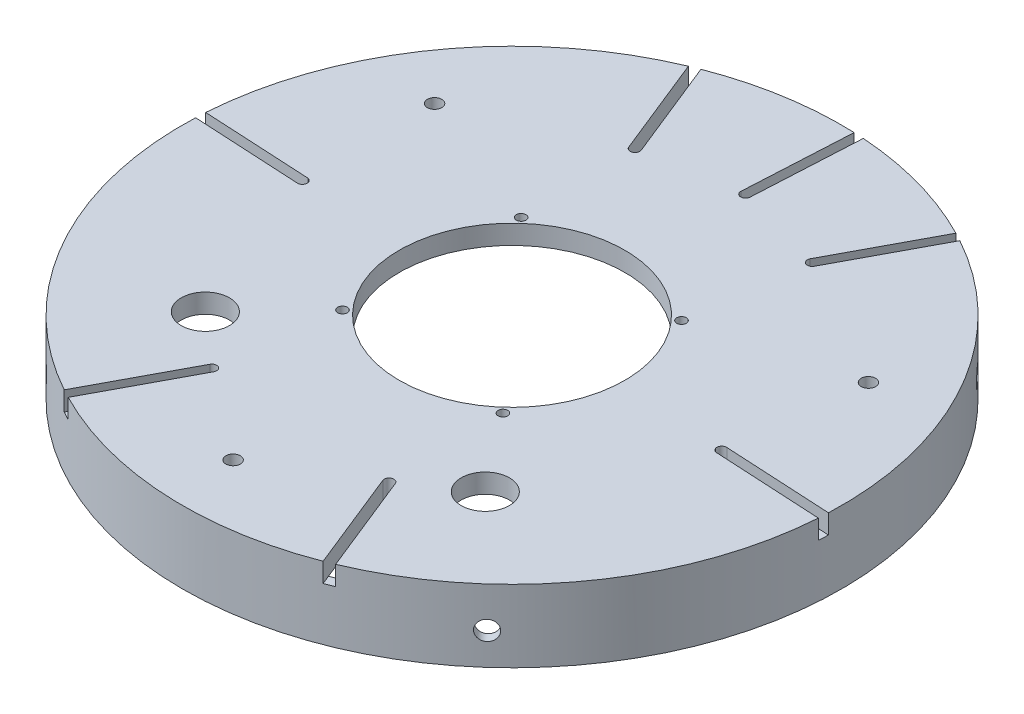
from build123d import *

# Parameters (mm, degrees)
SKETCH1_R                = 68.369999998
SKETCH1_R_2              = 23.401
BOSS_EXTRUDE1_DEPTH      = 2
BOSS_EXTRUDE2_START      = -13
SKETCH3_R                = 68.369999998
SKETCH3_R_2              = 66.37
BOSS_EXTRUDE2_DEPTH      = 13
CUT_EXTRUDE40_DEPTH      = 114.575806629
CUT_EXTRUDE40_DEPTH_BACK = 114.575806629
SKETCH63_R               = 2
CUT_EXTRUDE41_DEPTH      = 160.130961581
CUT_EXTRUDE41_DEPTH_BACK = 160.130961581
SKETCH64_R               = 2
CUT_EXTRUDE45_DEPTH      = 2
SKETCH73_R               = 1
CUT_EXTRUDE47_DEPTH      = 10
SKETCH70_R               = 1.5
CUT_EXTRUDE48_DEPTH      = 10
SKETCH74_R               = 5
CUT_EXTRUDE49_DEPTH      = 10
CUT_EXTRUDE51_START      = -2
CUT_EXTRUDE51_DEPTH      = 2
SKETCH80_R               = 5
SKETCH80_R_2             = 1.5
SKETCH80_R_3             = 1
SKETCH80_R_4             = 23.401
BOSS_EXTRUDE4_DEPTH      = 2


with BuildPart() as part:
    # Sketch1 → Boss-Extrude1 (new body)
    with BuildSketch(Plane(origin=(0, 0, 0), x_dir=(-0.9985653746512714, 0, -0.053546172109368295), z_dir=(0, 1, 0))):
        with Locations(Location((55.498672647, -32.344920806, 0), (0, 0, 93.069437642))):
            Circle(SKETCH1_R)
        with Locations(Location((55.498672647, -32.344920806, 0), (0, 0, 93.069437642))):
            Circle(SKETCH1_R_2, mode=Mode.SUBTRACT)
    extrude(amount=BOSS_EXTRUDE1_DEPTH)

    # Sketch3 → Boss-Extrude2 (add)
    with BuildSketch(Plane(origin=(0, 2, 0), x_dir=(1, 0, 0), z_dir=(0, 1, 0)).offset(BOSS_EXTRUDE2_START)):
        with Locations(Location((-53.687106148, 35.27025944, 0), (0, 0, 270))):
            Circle(SKETCH3_R)
        with Locations(Location((-53.687106148, 35.27025944, 0), (0, 0, 270))):
            Circle(SKETCH3_R_2, mode=Mode.SUBTRACT)
    extrude(amount=BOSS_EXTRUDE2_DEPTH)

    # Sketch63 → Cut-Extrude40 (cut, two sides: drawn at the far end of the back side and taken through both)
    with BuildSketch(Plane(origin=(-41.506941316, 0, -46.21062949), x_dir=(0.7439552092791144, 2.284460434874975e-13, -0.6682294864688846), z_dir=(0.6682294864688846, -2.5433421830845933e-13, 0.7439552092791144)).offset(-CUT_EXTRUDE40_DEPTH_BACK)):
        with Locations((-16.372174937, -4.35)):
            Circle(SKETCH63_R)
    extrude(amount=CUT_EXTRUDE40_DEPTH + CUT_EXTRUDE40_DEPTH_BACK, mode=Mode.SUBTRACT)

    # Sketch64 → Cut-Extrude41 (cut, two sides: drawn at the far end of the back side and taken through both)
    with BuildSketch(Plane(origin=(-12.180164832, 0, 10.94037005), x_dir=(-0.668229486468876, 1.5883353274739987e-15, -0.743955209279122), z_dir=(0.743955209279122, -1.7683301393964735e-15, -0.668229486468876)).offset(-CUT_EXTRUDE41_DEPTH_BACK)):
        with Locations((62.114800614, -4.35)):
            Circle(SKETCH64_R)
    extrude(amount=CUT_EXTRUDE41_DEPTH + CUT_EXTRUDE41_DEPTH_BACK, mode=Mode.SUBTRACT)

    # Sketch67 → Cut-Extrude45 (cut)
    with BuildSketch(Plane(origin=(0, 2, 0), x_dir=(1, 0, 0), z_dir=(0, 1, 0))):
        with BuildLine():
            Line((-47.831144931, 125.709400378), (-49.82827568, 125.816492726))
            Line((-49.82827568, 125.816492726), (-52.215508738, 81.297751413))
            ThreePointArc((-52.215508738, 81.297751413), (-51.270489538, 80.245639864), (-50.218377989, 81.190659065))
            Line((-50.218377989, 81.190659065), (-47.831144931, 125.709400378))
        make_face()
        with BuildLine():
            Line((-144.126247086, 41.126220657), (-144.233339434, 39.129089908))
            Line((-144.233339434, 39.129089908), (-99.714598121, 36.741856849))
            ThreePointArc((-99.714598121, 36.741856849), (-98.662486572, 37.68687605), (-99.607505773, 38.738987598))
            Line((-99.607505773, 38.738987598), (-144.126247086, 41.126220657))
        make_face()
        with BuildLine():
            Line((36.75203479, 29.414298222), (36.859127139, 31.411428971))
            Line((36.859127139, 31.411428971), (-7.659614175, 33.79866203))
            ThreePointArc((-7.659614175, 33.79866203), (-8.711725723, 32.853642829), (-7.766706523, 31.801531281))
            Line((-7.766706523, 31.801531281), (36.75203479, 29.414298222))
        make_face()
    extrude(amount=-CUT_EXTRUDE45_DEPTH, mode=Mode.SUBTRACT)

    # Sketch73 → Cut-Extrude47 (cut)
    with BuildSketch(Plane.XZ.offset(-2)):
        with Locations(Location((-72.2141021, -18.632644766, 0), (0, 0, 90))):
            Circle(SKETCH73_R)
        with Locations(Location((-37.049491474, -16.743263487, 0), (0, 0, 90))):
            Circle(SKETCH73_R)
        with Locations(Location((-35.160110195, -51.907874114, 0), (0, 0, 90))):
            Circle(SKETCH73_R)
        with Locations(Location((-70.324720822, -53.797255392, 0), (0, 0, 90))):
            Circle(SKETCH73_R)
    extrude(amount=CUT_EXTRUDE47_DEPTH, mode=Mode.SUBTRACT)

    # Sketch70 → Cut-Extrude48 (cut)
    with BuildSketch(Plane(origin=(0, 2, 0), x_dir=(1, 0, 0), z_dir=(0, 1, 0))):
        with Locations(Location((-99.774462502, 65.286181619, 0), (0, 0, 270))):
            Circle(SKETCH70_R)
        with Locations(Location((-56.637979096, -19.650523046, 0), (0, 0, 270))):
            Circle(SKETCH70_R)
        with Locations(Location((-4.648876845, 60.175119746, 0), (0, 0, 270))):
            Circle(SKETCH70_R)
    extrude(amount=-CUT_EXTRUDE48_DEPTH, mode=Mode.SUBTRACT)

    # Sketch74 → Cut-Extrude49 (cut)
    with BuildSketch(Plane(origin=(19.562495047, 3, -2.053609117), x_dir=(1, 0, 0), z_dir=(0, 1, 0))):
        with Locations(Location((-105.702188225, 2.042468777, 0), (0, 0, 270))):
            Circle(SKETCH74_R)
        with Locations(Location((-44.324158759, -1.255349618, 0), (0, 0, 270))):
            Circle(SKETCH74_R)
    extrude(amount=-CUT_EXTRUDE49_DEPTH, mode=Mode.SUBTRACT)

    # Sketch75 → Cut-Extrude51 (cut)
    with BuildSketch(Plane(origin=(0, 2, 0), x_dir=(1, 0, 0), z_dir=(0, 1, 0)).offset(CUT_EXTRUDE51_START)):
        with BuildLine():
            ThreePointArc((-78.28711428, 99.061297209), (-79.21750955, 98.694666428), (-80.142442845, 98.314466628))
            Line((-80.142442845, 98.314466628), (-79.765783898, 97.378744227))
            Line((-79.765783898, 97.378744227), (-71.802851111, 77.596671772))
            ThreePointArc((-71.802851111, 77.596671772), (-70.501771538, 77.04242278), (-69.947522546, 78.343502353))
            Line((-69.947522546, 78.343502353), (-77.910455333, 98.125574808))
            Line((-77.910455333, 98.125574808), (-78.28711428, 99.061297209))
        make_face()
        with BuildLine():
            Line((-21.107609811, 94.229039398), (-20.63291657, 95.119047657))
            ThreePointArc((-20.63291657, 95.119047657), (-21.511818593, 95.596106061), (-22.397604199, 96.060258351))
            Line((-22.397604199, 96.060258351), (-22.872297441, 95.170250092))
            Line((-22.872297441, 95.170250092), (-32.907769586, 76.354618611))
            ThreePointArc((-32.907769586, 76.354618611), (-32.496031118, 75.00166945), (-31.143081956, 75.413407918))
            Line((-31.143081956, 75.413407918), (-21.107609811, 94.229039398))
        make_face()
        with BuildLine():
            Line((-76.23113034, -4.872889039), (-86.266602485, -23.688520519))
            Line((-86.266602485, -23.688520519), (-86.741295726, -24.578528778))
            ThreePointArc((-86.741295726, -24.578528778), (-85.862393702, -25.055587182), (-84.976608096, -25.519739471))
            Line((-84.976608096, -25.519739471), (-84.501914855, -24.629731212))
            Line((-84.501914855, -24.629731212), (-74.46644271, -5.814099732))
            ThreePointArc((-74.46644271, -5.814099732), (-74.878181178, -4.461150571), (-76.23113034, -4.872889039))
        make_face()
        with BuildLine():
            Line((-29.463756963, -27.585055929), (-29.087098016, -28.52077833))
            ThreePointArc((-29.087098016, -28.52077833), (-28.156702745, -28.154147549), (-27.231769451, -27.773947749))
            Line((-27.231769451, -27.773947749), (-27.608428398, -26.838225348))
            Line((-27.608428398, -26.838225348), (-35.571361185, -7.056152893))
            ThreePointArc((-35.571361185, -7.056152893), (-36.872440758, -6.501903901), (-37.42668975, -7.802983474))
            Line((-37.42668975, -7.802983474), (-29.463756963, -27.585055929))
        make_face()
    extrude(amount=CUT_EXTRUDE51_DEPTH, mode=Mode.SUBTRACT)

    # Sketch80 → Boss-Extrude4 (add)
    with BuildSketch(Plane(origin=(0, 2, 0), x_dir=(1, 0, 0), z_dir=(0, 1, 0))):
        with BuildLine():
            Line((-29.087098016, -28.52077833), (-37.42668975, -7.802983474))
            ThreePointArc((-37.42668975, -7.802983474), (-36.872440758, -6.501903901), (-35.571361185, -7.056152893))
            Line((-35.571361185, -7.056152893), (-27.231769451, -27.773947749))
            ThreePointArc((-27.231769451, -27.773947749), (1.922948187, -4.503837114), (14.523625835, 30.606254489))
            Line((14.523625835, 30.606254489), (-7.766706523, 31.801531281))
            ThreePointArc((-7.766706523, 31.801531281), (-8.711725723, 32.853642829), (-7.659614175, 33.79866203))
            Line((-7.659614175, 33.79866203), (14.630861042, 32.603377578))
            ThreePointArc((14.630861042, 32.603377578), (5.862291778, 68.860825176), (-20.63291657, 95.119047657))
            Line((-20.63291657, 95.119047657), (-31.143081956, 75.413407918))
            ThreePointArc((-31.143081956, 75.413407918), (-32.496031118, 75.00166945), (-32.907769586, 76.354618611))
            Line((-32.907769586, 76.354618611), (-22.397604199, 96.060258351))
            ThreePointArc((-22.397604199, 96.060258351), (-35.331439872, 101.130159344), (-49.023101197, 103.480991422))
            Line((-49.023101197, 103.480991422), (-50.218377989, 81.190659065))
            ThreePointArc((-50.218377989, 81.190659065), (-51.270489538, 80.245639864), (-52.215508738, 81.297751413))
            Line((-52.215508738, 81.297751413), (-51.020224286, 103.588226629))
            ThreePointArc((-51.020224286, 103.588226629), (-64.884819285, 102.71703935), (-78.28711428, 99.061297209))
            Line((-78.28711428, 99.061297209), (-69.947522546, 78.343502353))
            ThreePointArc((-69.947522546, 78.343502353), (-70.501771538, 77.04242278), (-71.802851111, 77.596671772))
            Line((-71.802851111, 77.596671772), (-80.142442845, 98.314466628))
            ThreePointArc((-80.142442845, 98.314466628), (-109.297160483, 75.044355993), (-121.89783813, 39.93426439))
            Line((-121.89783813, 39.93426439), (-99.607505773, 38.738987598))
            ThreePointArc((-99.607505773, 38.738987598), (-98.662486572, 37.68687605), (-99.714598121, 36.741856849))
            Line((-99.714598121, 36.741856849), (-122.005073337, 37.937141302))
            ThreePointArc((-122.005073337, 37.937141302), (-113.236504074, 1.679693704), (-86.741295726, -24.578528778))
            Line((-86.741295726, -24.578528778), (-76.23113034, -4.872889039))
            ThreePointArc((-76.23113034, -4.872889039), (-74.878181178, -4.461150571), (-74.46644271, -5.814099732))
            Line((-74.46644271, -5.814099732), (-84.976608096, -25.519739471))
            ThreePointArc((-84.976608096, -25.519739471), (-57.353015371, -33.00138921), (-29.087098016, -28.52077833))
        make_face()
        with Locations(Location((-86.139693179, 4.096077895, 0), (0, 0, 270))):
            Circle(SKETCH80_R, mode=Mode.SUBTRACT)
        with Locations(Location((-99.774462502, 65.286181619, 0), (0, 0, 270))):
            Circle(SKETCH80_R_2, mode=Mode.SUBTRACT)
        with Locations(Location((-35.160110195, 51.907874114, 0), (0, 0, 270))):
            Circle(SKETCH80_R_3, mode=Mode.SUBTRACT)
        with Locations(Location((-53.687106148, 35.27025944, 0), (0, 0, 270))):
            Circle(SKETCH80_R_4, mode=Mode.SUBTRACT)
        with Locations(Location((-70.324720822, 53.797255392, 0), (0, 0, 270))):
            Circle(SKETCH80_R_3, mode=Mode.SUBTRACT)
        with Locations(Location((-37.049491474, 16.743263487, 0), (0, 0, 270))):
            Circle(SKETCH80_R_3, mode=Mode.SUBTRACT)
        with Locations(Location((-72.2141021, 18.632644766, 0), (0, 0, 270))):
            Circle(SKETCH80_R_3, mode=Mode.SUBTRACT)
        with Locations(Location((-56.637979096, -19.650523046, 0), (0, 0, 270))):
            Circle(SKETCH80_R_2, mode=Mode.SUBTRACT)
        with Locations(Location((-4.648876845, 60.175119746, 0), (0, 0, 270))):
            Circle(SKETCH80_R_2, mode=Mode.SUBTRACT)
        with Locations(Location((-24.761663712, 0.798259499, 0), (0, 0, 270))):
            Circle(SKETCH80_R, mode=Mode.SUBTRACT)
    extrude(amount=BOSS_EXTRUDE4_DEPTH)


solid = part.part
